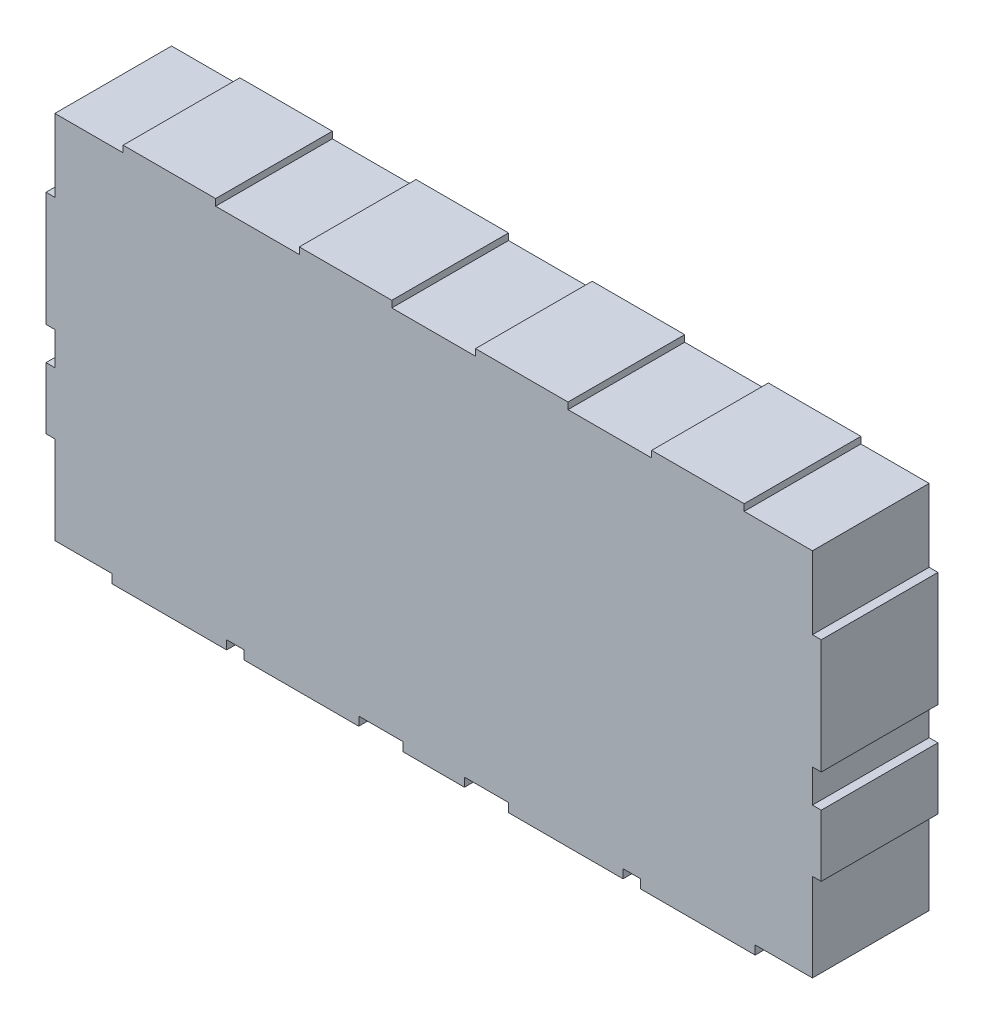
from build123d import *

# Parameters (mm, degrees)
COMPONENT_OUTLINE_DEPTH = 2.65


with BuildPart() as part:
    # 草图1 → Component_Outline (new body)
    with BuildSketch(Plane.XY):
        Polygon((7.05, 4.35), (7.05, 4.2), (8.6, 4.2), (8.6, 2.55), (8.8, 2.55), (8.8, -0.05), (8.6, -0.05), (8.6, -0.8), (8.8, -0.8), (8.8, -2.2), (8.6, -2.2), (8.6, -4.2), (7.3, -4.2), (7.3, -4.4), (4.7, -4.4), (4.7, -4.2), (4.3, -4.2), (4.3, -4.4), (1.7, -4.4), (1.7, -4.2), (0.7, -4.2), (0.7, -4.4), (-0.7, -4.4), (-0.7, -4.2), (-1.7, -4.2), (-1.7, -4.4), (-4.3, -4.4), (-4.3, -4.2), (-4.7, -4.2), (-4.7, -4.4), (-7.3, -4.4), (-7.3, -4.2), (-8.6, -4.2), (-8.6, -2.2), (-8.8, -2.2), (-8.8, -0.8), (-8.6, -0.8), (-8.6, -0.05), (-8.8, -0.05), (-8.8, 2.55), (-8.6, 2.55), (-8.6, 4.2), (-7.05, 4.2), (-7.05, 4.35), (-4.95, 4.35), (-4.95, 4.2), (-3.05, 4.2), (-3.05, 4.35), (-0.95, 4.35), (-0.95, 4.2), (0.95, 4.2), (0.95, 4.35), (3.05, 4.35), (3.05, 4.2), (4.95, 4.2), (4.95, 4.35), align=None)
    extrude(amount=COMPONENT_OUTLINE_DEPTH)


solid = part.part
